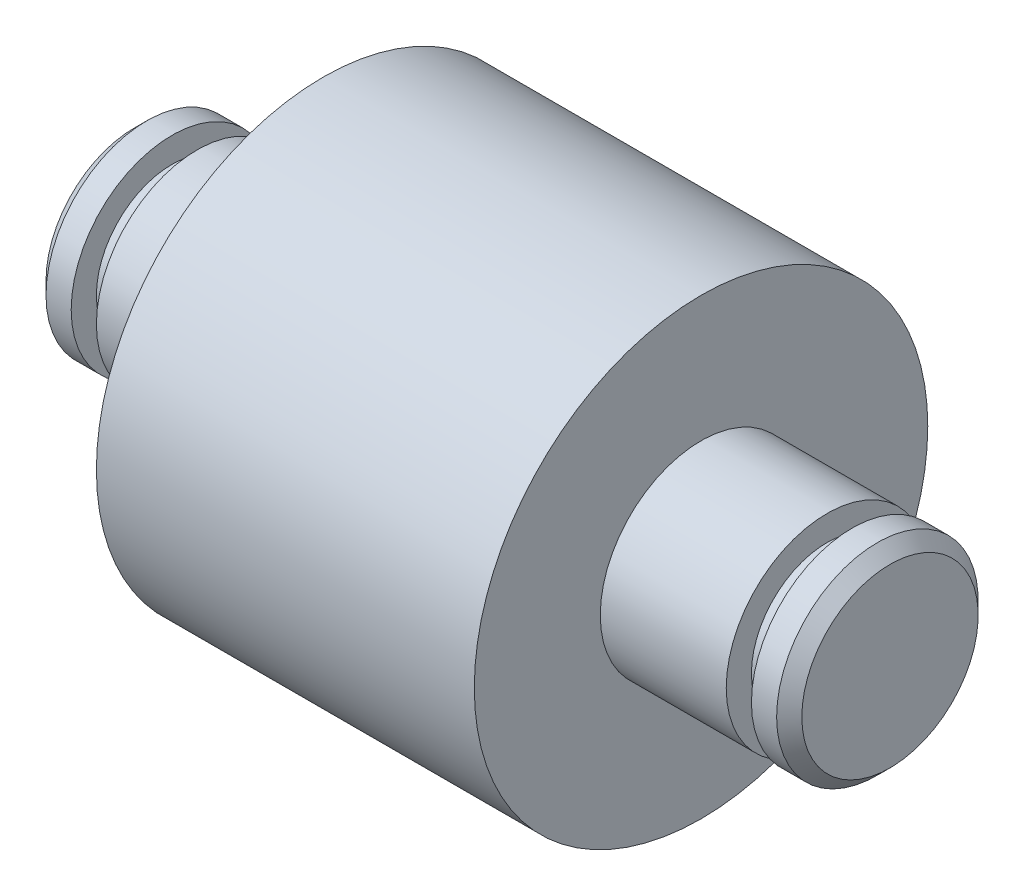
from build123d import *


with BuildPart() as part:
    # Sketch1 → Revolve1 (revolve)
    with BuildSketch(Plane.XY, mode=Mode.PRIVATE) as revolve1_sk:
        Polygon((0, 0), (0, 3.5), (0.5, 4), (1.5, 4), (1.5, 3), (2.5, 3), (2.5, 4), (7.5, 4), (7.5, 9), (22.5, 9), (22.5, 4), (27.5, 4), (27.5, 3), (28.5, 3), (28.5, 4), (29.5, 4), (30, 3.5), (30, 0), align=None)
    revolve(revolve1_sk.sketch.rotate(Axis((0, 0, 0), (1, 0, 0)), 90), axis=Axis((0, 0, 0), (1, 0, 0)))


solid = part.part
